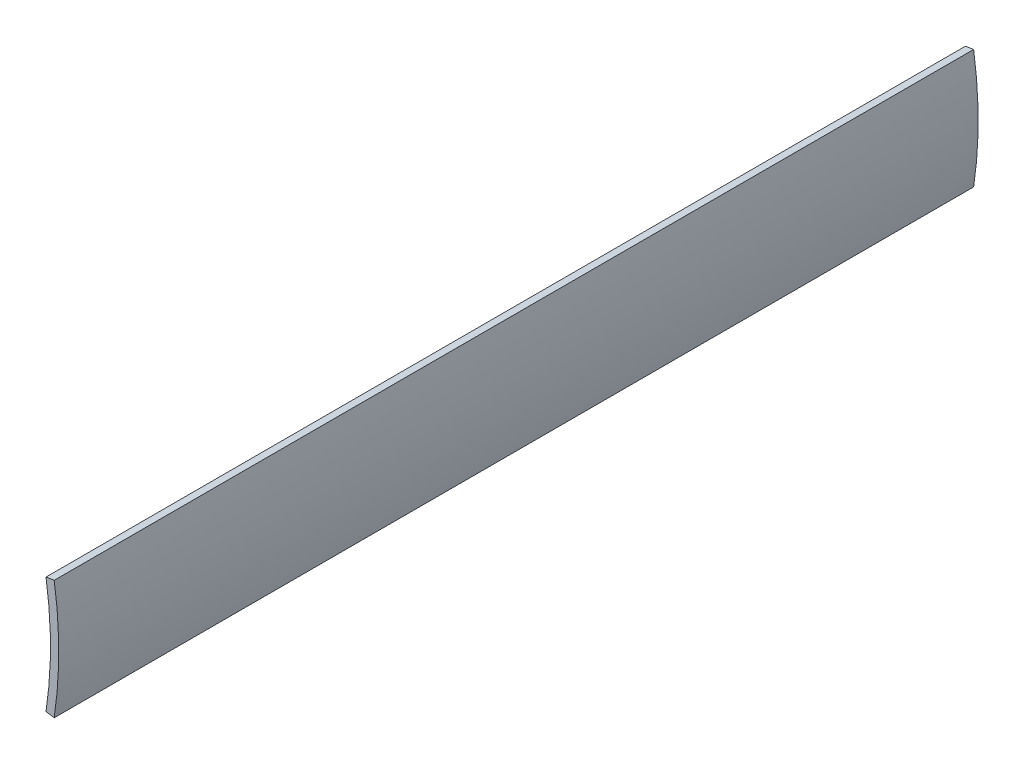
from build123d import *

# Parameters (mm, degrees)
BOSS_EXTRUDE1_DEPTH = 1800


with BuildPart() as part:
    # Sketch2 → Boss-Extrude1 (new body)
    with BuildSketch(Plane.XY):
        with BuildLine():
            Line((741.271132851, 114.092539642), (757.332007396, 116.564544668))
            ThreePointArc((757.332007396, 116.564544668), (766.25, 0), (757.332007396, -116.564544668))
            Line((757.332007396, -116.564544668), (741.271132851, -114.092539642))
            ThreePointArc((741.271132851, -114.092539642), (750, 0), (741.271132851, 114.092539642))
        make_face()
    extrude(amount=BOSS_EXTRUDE1_DEPTH)


solid = part.part
